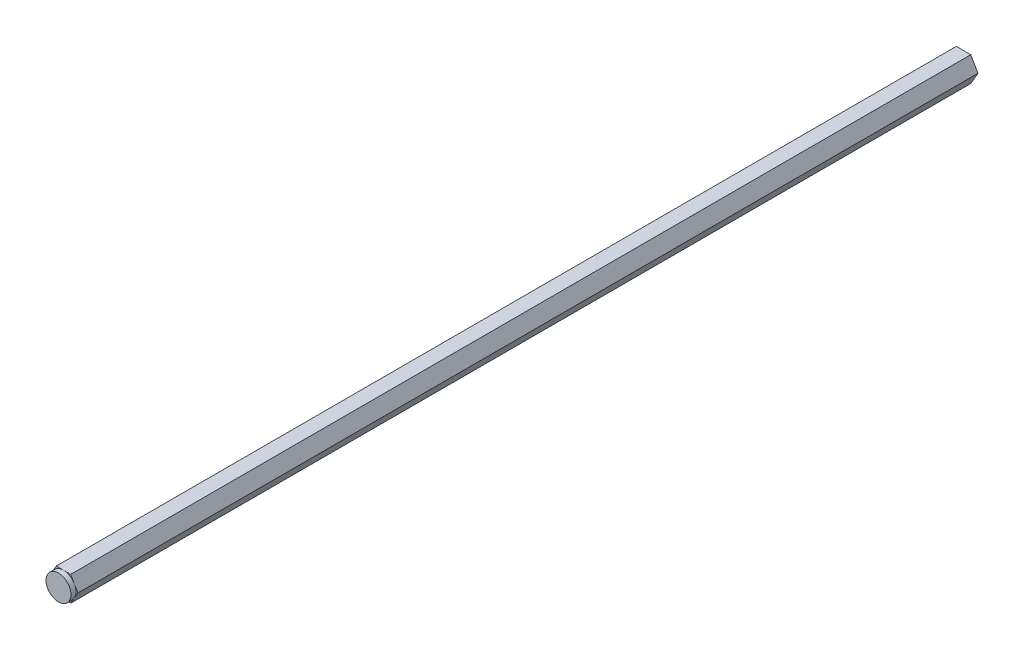
from build123d import *

# Parameters (mm, degrees)
BOSS_EXTRUDE1_DEPTH = 457.2
SKETCH2_R           = 6.35
BOSS_EXTRUDE2_DEPTH = 2.54


with BuildPart() as part:
    # Sketch1 → Boss-Extrude1 (new body)
    with BuildSketch(Plane.XY):
        Polygon((7.332348419, 0), (3.666174209, 6.35), (-3.666174209, 6.35), (-7.332348419, 0), (-3.666174209, -6.35), (3.666174209, -6.35), align=None)
    extrude(amount=BOSS_EXTRUDE1_DEPTH)

    # Sketch2 → Boss-Extrude2 (add)
    with BuildSketch(Plane.XY.offset(457.2)):
        with Locations(Location((0, 0, 0), (0, 0, 150))):
            Circle(SKETCH2_R)
    extrude(amount=BOSS_EXTRUDE2_DEPTH)


solid = part.part
